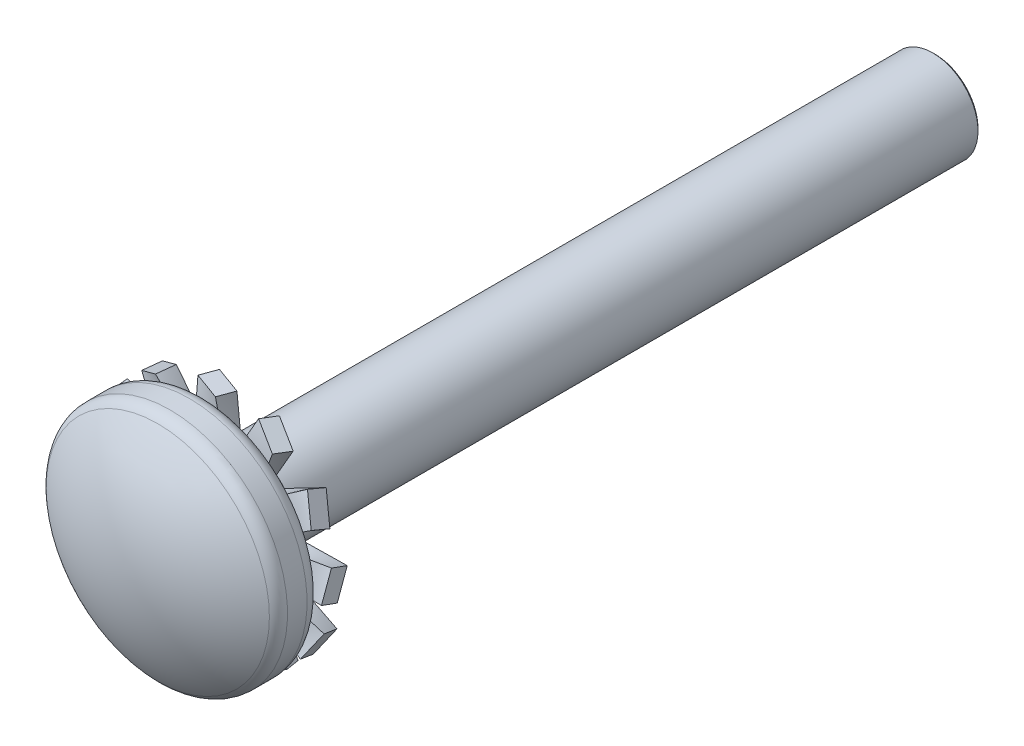
from build123d import *

# Parameters (mm, degrees)
SKETCH3_W           = 25.4
SKETCH3_H           = 1.567244252
SKETCH38_OUTSIDE_W  = 63.284
SKETCH38_OUTSIDE_H  = 63.284
SKETCH38_OUTSIDE_R  = 1.4874875
EXTRUDE6_DEPTH      = 26.496519549
EXTRUDE6_DRAFT      = -45
SKETCH8_W           = 2.921
SKETCH8_H           = 4.0894
SKETCH21_R          = 2.690784338
SKETCH21_R_2        = 1.567244252
EXTRUDE2_DEPTH      = 0.5842
EXTRUDE3_REACH      = 31.407
EXTRUDE3_END_RADIUS = 2.690784338
SKETCH33_W          = 1.016
SKETCH33_H          = 0.5842
CIRPATTERN4_COUNT   = 12


with BuildPart() as part:
    # Sketch3 → Revolve1 (revolve)
    with BuildSketch(Plane(origin=(0, 0, 0), x_dir=(0, 0, -1), z_dir=(1, 0, 0))):
        with Locations((-12.7, 0.783622126)):
            Rectangle(SKETCH3_W, SKETCH3_H)
    revolve(axis=Axis((0, 0, 0), (0, 0, 1)))


with BuildPart() as extrude6_tool:
    # Sketch38 outside → Extrude6 (with draft: the straight prism first)
    with BuildSketch(Plane(origin=(0, 0, 0), x_dir=(-1, 0, 0), z_dir=(0, 0, -1))):
        Rectangle(SKETCH38_OUTSIDE_W, SKETCH38_OUTSIDE_H)
        Circle(SKETCH38_OUTSIDE_R, mode=Mode.SUBTRACT)
    extrude(amount=-EXTRUDE6_DEPTH)
    # Extrude6: the draft: its side faces are tilted about the plane it starts from
    extrude6_sides = [extrude6_tool.faces().sort_by_distance(p)[0] for p in [
        (0, -31.642, 13.248259774),
        (-31.642, 0, 13.248259774),
        (0, 31.642, 13.248259774),
        (31.642, 0, 13.248259774),
        (1.4874875, 0, 13.248259774),
    ]]
    draft(extrude6_sides, Plane(origin=(0, 0, 0), x_dir=(-1, 0, 0), z_dir=(0, 0, -1)), EXTRUDE6_DRAFT)


with BuildPart() as part_1:
    add(part.part)

    # Extrude6: cut by extrude6_tool
    add(extrude6_tool.part, mode=Mode.SUBTRACT)

    # Sketch8 → Revolve2 (revolve)
    with BuildSketch(Plane(origin=(0, 0, 0), x_dir=(0, 0, -1), z_dir=(1, 0, 0)), mode=Mode.PRIVATE) as revolve2_sk:
        with Locations((-26.8605, 2.0447)):
            Rectangle(SKETCH8_W, SKETCH8_H)
    revolve(revolve2_sk.sketch.rotate(Axis((0, 0, 0), (0, 0, 1)), 90), axis=Axis((0, 0, 0), (0, 0, 1)))

    # Sketch11 → Cut-Revolve3 (revolve, cut)
    with BuildSketch(Plane(origin=(0, 0, 0), x_dir=(0, 0, -1), z_dir=(1, 0, 0)), mode=Mode.PRIVATE) as cut_revolve3_sk:
        with BuildLine():
            Line((-26.604906874, 4.0894), (-25.92578, 4.0894))
            ThreePointArc((-25.92578, 4.0894), (-25.553997397, 3.935402603), (-25.4, 3.56362))
            Line((-25.4, 3.56362), (-24.765, 3.56362))
            Line((-24.765, 3.56362), (-24.765, 4.7244))
            Line((-24.765, 4.7244), (-28.956, 4.7244))
            Line((-28.956, 4.7244), (-28.956, 0))
            Line((-28.956, 0), (-28.321, 0))
            ThreePointArc((-28.321, 0), (-27.988470898, 2.045152261), (-27.025141868, 3.87960601))
            ThreePointArc((-27.025141868, 3.87960601), (-26.839753083, 4.034036694), (-26.604906874, 4.0894))
        make_face()
    revolve(cut_revolve3_sk.sketch.rotate(Axis((0, 0, 28.321), (0, 0, -1)), 180), axis=Axis((0, 0, 28.321), (0, 0, -1)), mode=Mode.SUBTRACT)


with BuildPart() as body_2:
    # Sketch21 → Extrude2 (new body)
    with BuildSketch(Plane.XY.offset(25.243869553)):
        Circle(SKETCH21_R)
        Circle(SKETCH21_R_2, mode=Mode.SUBTRACT)
    extrude(amount=-EXTRUDE2_DEPTH)

    # Extrude3: up to this cylinder (the profile starts outside it)
    extrude3_end = Plane(origin=(0, 0, 24.95177), z_dir=(0, 0, 1)) * Cylinder(EXTRUDE3_END_RADIUS, 69.195568677, mode=Mode.PRIVATE)
    # Sketch33 → Extrude3 (add, up to the surface)
    with BuildSketch(Plane(origin=(0, 2.690784338, 0), x_dir=(-1, 0, 0), z_dir=(0, 1, 0)), mode=Mode.PRIVATE) as extrude3_sk1:
        with Locations((0, 24.951769553)):
            Rectangle(SKETCH33_W, SKETCH33_H)
    extrude3_tool1 = extrude(extrude3_sk1.sketch, amount=-EXTRUDE3_REACH, mode=Mode.PRIVATE) - extrude3_end
    extrude3 = extrude3_tool1.solids().sort_by_distance((0, 2.690784, 24.95177))[0] + extrude3_tool1.solids().sort_by_distance((0, 2.690784, 24.95177))[1]
    add(extrude3)

    # Sketch32 → Loft2 section 0
    with BuildSketch(Plane(origin=(0, 4.064, 0), x_dir=(-1, 0, 0), z_dir=(0, 1, 0))):
        with BuildLine():
            Line((-0.377459767, 25.4), (-0.577267935, 24.851031571))
            Line((-0.577267935, 24.851031571), (0.377459767, 24.503539105))
            Line((0.377459767, 24.503539105), (0.577267935, 25.052507534))
            Line((0.577267935, 25.052507534), (-0.377459767, 25.4))
        make_face()
    # Sketch31 → Loft2 section 1
    with BuildSketch(Plane(origin=(0, 2.690784338, 0), x_dir=(-1, 0, 0), z_dir=(0, 1, 0))):
        with BuildLine():
            Line((-0.508, 25.243869553), (0.508, 25.243869553))
            Line((0.508, 25.243869553), (0.508, 24.659669553))
            Line((0.508, 24.659669553), (-0.508, 24.659669553))
            Line((-0.508, 24.659669553), (-0.508, 25.243869553))
        make_face()
    loft2 = loft()

    # CirPattern4: Extrude3, Loft2 ×12 about axis
    cirpattern4_axis = Axis((0, 0, 24.659669553), (0, 0, 1))
    add([extrude3.rotate(cirpattern4_axis, i * 360 / CIRPATTERN4_COUNT) for i in range(1, CIRPATTERN4_COUNT)])
    add([loft2.rotate(cirpattern4_axis, i * 360 / CIRPATTERN4_COUNT) for i in range(1, CIRPATTERN4_COUNT)])


solid = Compound([part_1.part, body_2.part])
